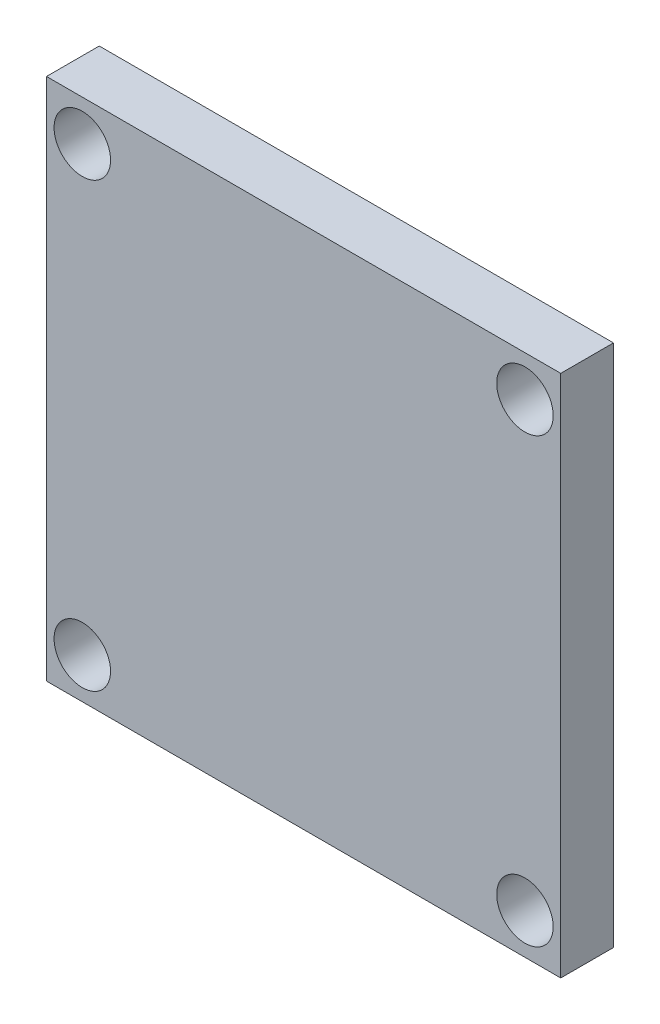
from build123d import *

# Parameters (mm, degrees)
SKETCH1_W           = 27.3
SKETCH1_H           = 27.8
BOSS_EXTRUDE1_DEPTH = 2.8
SKETCH2_R           = 1.5
CUT_EXTRUDE1_DEPTH  = 40.063665983


with BuildPart() as part:
    # Sketch1 → Boss-Extrude1 (new body)
    with BuildSketch(Plane.XY):
        with Locations((13.65, 13.9)):
            Rectangle(SKETCH1_W, SKETCH1_H)
    extrude(amount=BOSS_EXTRUDE1_DEPTH)

    # Sketch2 → Cut-Extrude1 (cut, through all)
    with BuildSketch(Plane.XY.offset(2.8)):
        with Locations((1.9, 25.65)):
            Circle(SKETCH2_R)
        with Locations((25.4, 25.65)):
            Circle(SKETCH2_R)
        with Locations((25.4, 2.15)):
            Circle(SKETCH2_R)
        with Locations((1.9, 2.15)):
            Circle(SKETCH2_R)
    extrude(amount=-CUT_EXTRUDE1_DEPTH, mode=Mode.SUBTRACT)


solid = part.part
